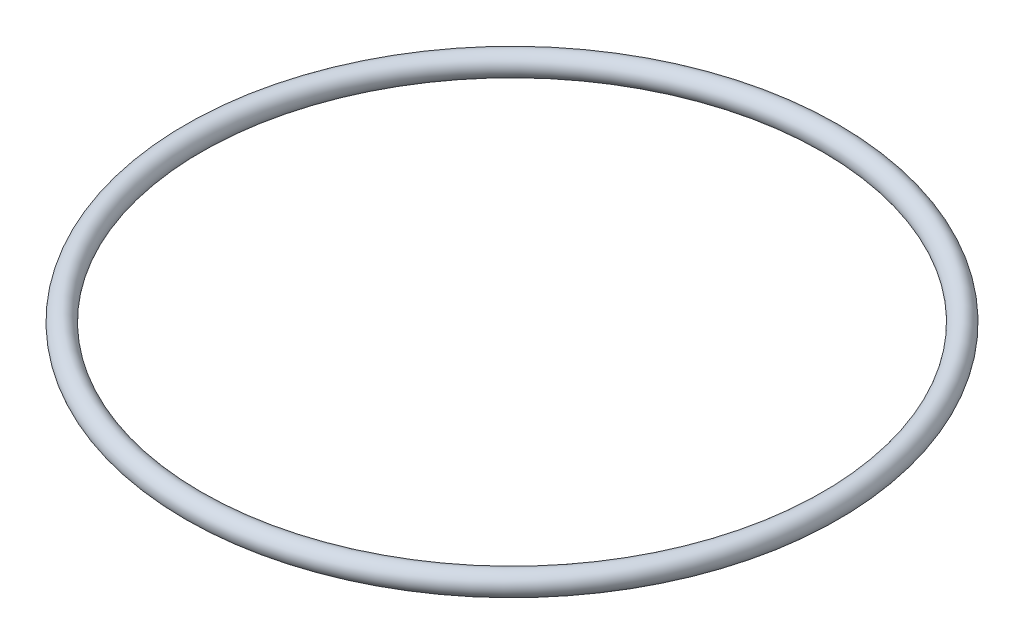
from build123d import *

# Parameters (mm, degrees)
SKETCH1_R = 0.9


with BuildPart() as part:
    # Sketch1 → Revolve1 (revolve)
    with BuildSketch(Plane(origin=(0, 0, 0), x_dir=(0, 0, -1), z_dir=(1, 0, 0)), mode=Mode.PRIVATE) as revolve1_sk:
        with Locations((-25.7, 0)):
            Circle(SKETCH1_R)
    revolve(revolve1_sk.sketch.rotate(Axis((0, -6.843396226, 0), (0, 1, 0)), 180), axis=Axis((0, -6.843396226, 0), (0, 1, 0)))


solid = part.part
